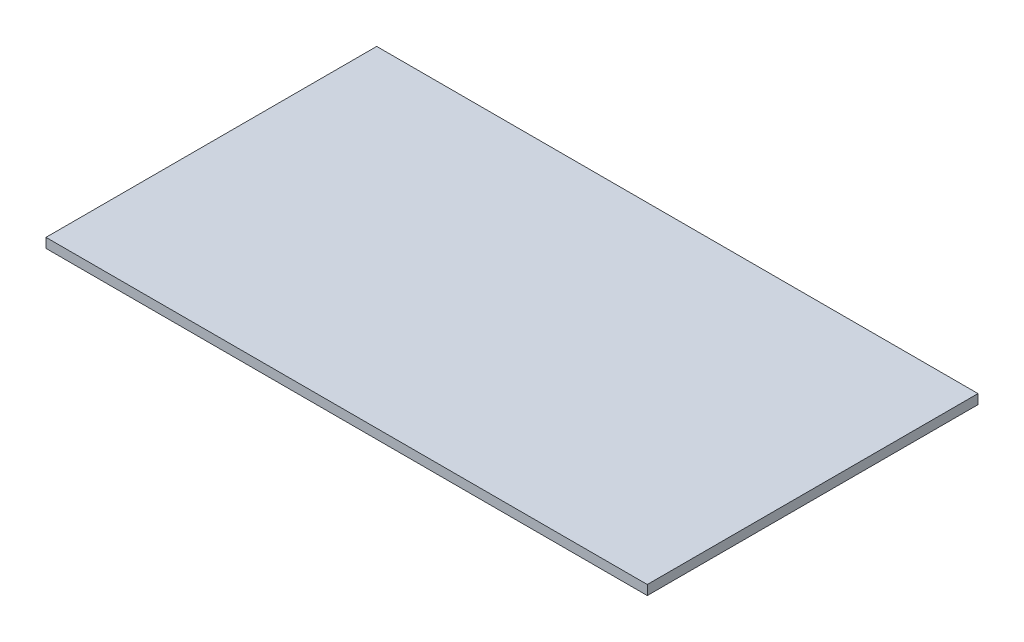
from build123d import *

# Parameters (mm, degrees)
SKETCH1_W           = 100
SKETCH1_H           = 55
PLATE_EXTRUDE_DEPTH = 1.6


with BuildPart() as part:
    # Sketch1 → Plate_Extrude (new body)
    with BuildSketch(Plane(origin=(0, 0, 0), x_dir=(1, 0, 0), z_dir=(0, 1, 0))):
        Rectangle(SKETCH1_W, SKETCH1_H)
    extrude(amount=PLATE_EXTRUDE_DEPTH)


solid = part.part
